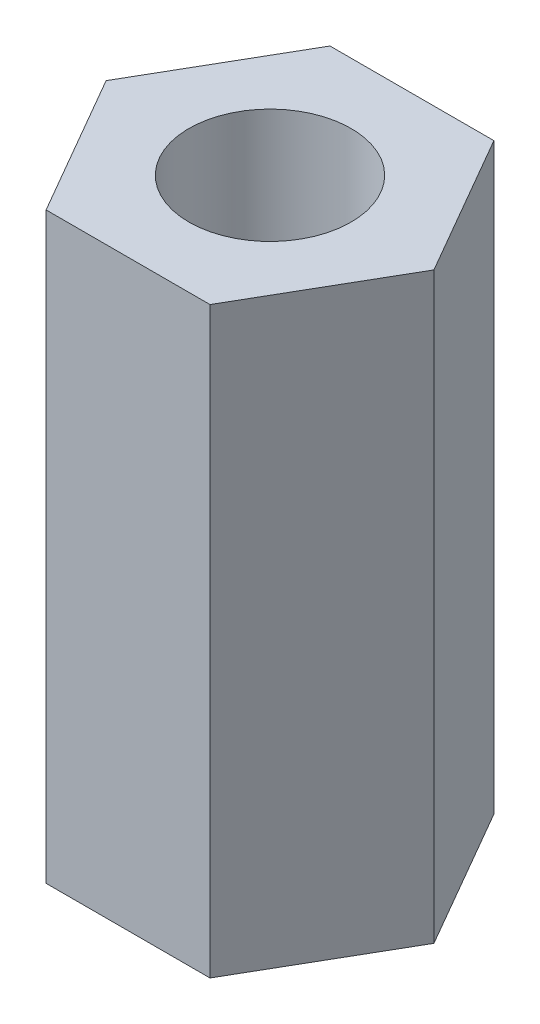
from build123d import *

# Parameters (mm, degrees)
SKETCH1_R           = 2
BOSS_EXTRUDE1_DEPTH = 14.38


with BuildPart() as part:
    # Sketch1 → Boss-Extrude1 (new body)
    with BuildSketch(Plane(origin=(0, 0, 0), x_dir=(1, 0, 0), z_dir=(0, 1, 0))):
        Polygon((2.020725942, 3.5), (-2.020725942, 3.5), (-4.041451884, 0), (-2.020725942, -3.5), (2.020725942, -3.5), (4.041451884, 0), align=None)
        with Locations(Location((0, 0, 0), (0, 0, 270))):
            Circle(SKETCH1_R, mode=Mode.SUBTRACT)
    extrude(amount=BOSS_EXTRUDE1_DEPTH)


solid = part.part
